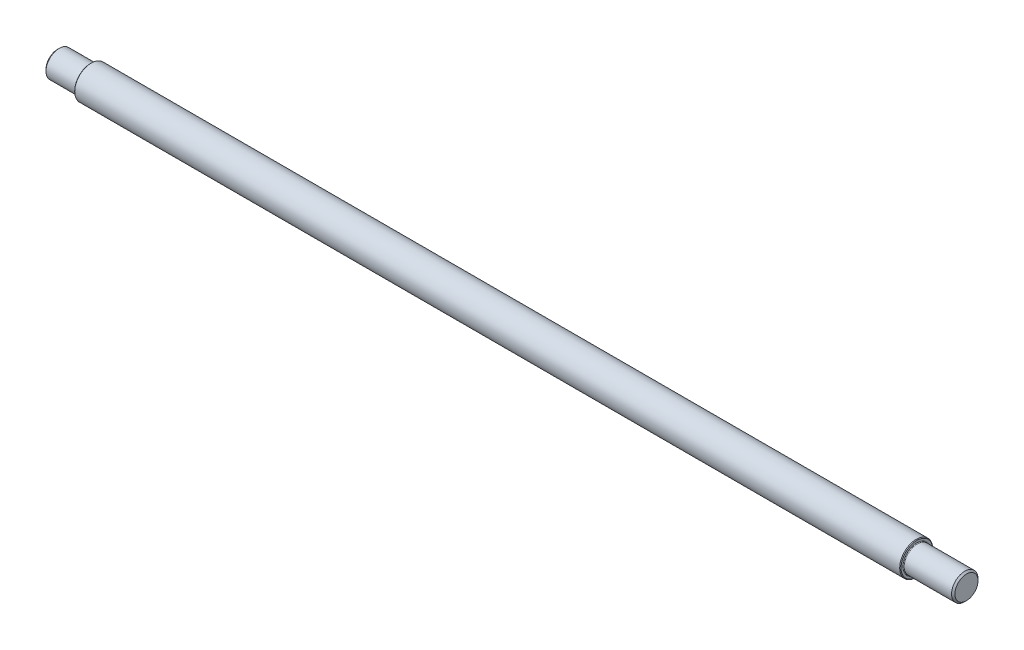
from build123d import *

# Parameters (mm, degrees)
CHAMFER1_SIZE = 0.2
CHAMFER2_SIZE = 0.2
CHAMFER3_SIZE = 0.5
CHAMFER4_SIZE = 0.5
FILLET1_R     = 0.2
FILLET2_R     = 0.2


with BuildPart() as part:
    # Sketch1 → Revolve1 (revolve)
    with BuildSketch(Plane.XY):
        Polygon((0, 0), (275, 0), (275, 4), (260, 4), (260, 5), (10, 5), (10, 4), (0, 4), align=None)
    revolve(axis=Axis((0, 0, 0), (1, 0, 0)))

    # Chamfer1
    chamfer1_edges = [part.edges().sort_by_distance(p)[0] for p in [
        (260, -5, 0),
    ]]
    chamfer(chamfer1_edges, length=CHAMFER1_SIZE)

    # Chamfer2
    chamfer2_edges = [part.edges().sort_by_distance(p)[0] for p in [
        (10, -5, 0),
    ]]
    chamfer(chamfer2_edges, length=CHAMFER2_SIZE)

    # Chamfer3
    chamfer3_edges = [part.edges().sort_by_distance(p)[0] for p in [
        (0, -4, 0),
    ]]
    chamfer(chamfer3_edges, length=CHAMFER3_SIZE)

    # Chamfer4
    chamfer4_edges = [part.edges().sort_by_distance(p)[0] for p in [
        (275, -4, 0),
    ]]
    chamfer(chamfer4_edges, length=CHAMFER4_SIZE)

    # Fillet1
    fillet1_edges = [part.edges().sort_by_distance(p)[0] for p in [
        (10, -4, 0),
    ]]
    fillet(fillet1_edges, radius=FILLET1_R)

    # Fillet2
    fillet2_edges = [part.edges().sort_by_distance(p)[0] for p in [
        (260, -4, 0),
    ]]
    fillet(fillet2_edges, radius=FILLET2_R)


solid = part.part
